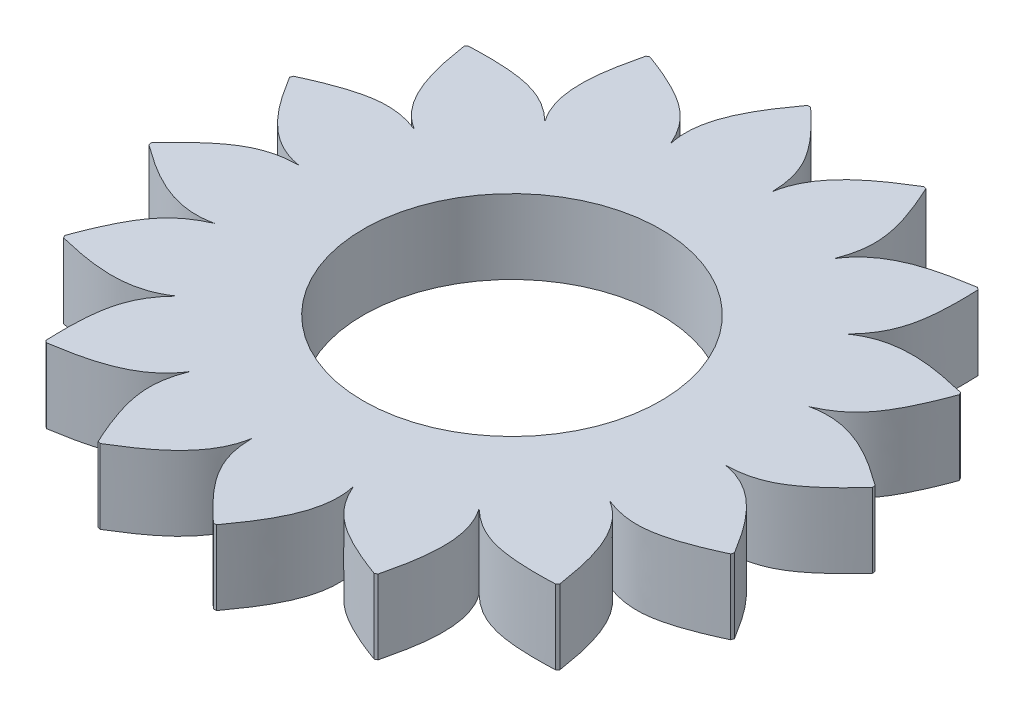
from build123d import *

# Parameters (mm, degrees)
SKETCH3_R           = 19.898430298
BOSS_EXTRUDE1_DEPTH = 6.35
BOSS_EXTRUDE2_DEPTH = 6.35
CIRPATTERN1_COUNT   = 16
SKETCH5_R           = 12.7
CUT_EXTRUDE1_DEPTH  = 41.290772811


with BuildPart() as part:
    # Sketch3 → Boss-Extrude1 (new body)
    with BuildSketch(Plane(origin=(0, 0, 0), x_dir=(1, 0, 0), z_dir=(0, 1, 0))):
        with Locations(Location((0, 0, 0), (0, 0, 270))):
            Circle(SKETCH3_R)
    extrude(amount=BOSS_EXTRUDE1_DEPTH)

    # Sketch4 → Boss-Extrude2 (add)
    with BuildSketch(Plane(origin=(0, 0, 0), x_dir=(1, 0, 0), z_dir=(0, 1, 0))):
        with BuildLine():
            Line((1.988478018, 20.052825306), (1.988478018, 19.798825306))
            ThreePointArc((1.988478018, 19.798825306), (-1.950387235, 19.802613917), (-5.812829174, 19.030463612))
            Line((-5.812829174, 19.030463612), (-5.862382116, 19.279583074))
            add(Edge.make_bspline(
                [(-2.898476267, 28.108453205), (-3.6130336, 27.120887472), (-5.51050926, 24.413306859), (-6.393741318, 21.275894599), (-5.862382116, 19.279583074)],
                knots=[0.009892854, 0.009892854, 0.009892854, 0.009892854, 0.401482073, 1, 1, 1, 1], degree=3))
            ThreePointArc((-2.898476267, 28.108453205), (-2.769719343, 28.121432414), (-2.640904329, 28.133821827))
            add(Edge.make_bspline(
                [(-2.640904329, 28.133821827), (-1.747412498, 27.304635113), (-0.175879044, 25.791834729), (1.64701783, 23.095158006), (1.988478018, 21.20759249), (1.988478018, 20.052825306)],
                knots=[0.009892854, 0.009892854, 0.009892854, 0.009892854, 0.401482073, 0.665435678, 1, 1, 1, 1], degree=3))
        make_face()
    boss_extrude2 = extrude(amount=BOSS_EXTRUDE2_DEPTH)

    # CirPattern1: Boss-Extrude2 ×16 about axis
    cirpattern1_axis = Axis((0, 6.35, 0), (0, -1, 0))
    for i in range(1, CIRPATTERN1_COUNT):
        add(boss_extrude2.rotate(cirpattern1_axis, i * 360 / CIRPATTERN1_COUNT))

    # Sketch5 → Cut-Extrude1 (cut, through all)
    with BuildSketch(Plane(origin=(0, 6.35, 0), x_dir=(1, 0, 0), z_dir=(0, 1, 0))):
        with Locations(Location((0, 0, 0), (0, 0, 270))):
            Circle(SKETCH5_R)
    extrude(amount=-CUT_EXTRUDE1_DEPTH, mode=Mode.SUBTRACT)


solid = part.part
